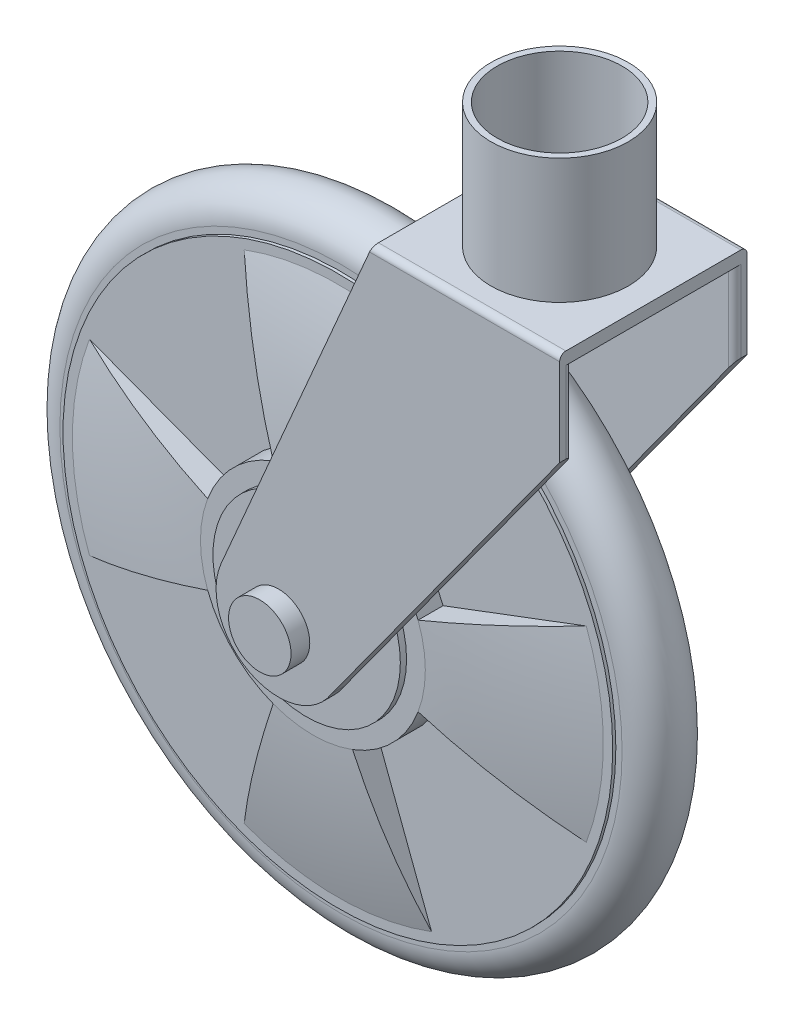
from build123d import *

# Parameters (mm, degrees)
RESSALTO_EXTRUS_O1_DEPTH  = 4
ESBO_O5_R                 = 15
RESSALTO_EXTRUS_O2_DEPTH  = 1
ESBO_O6_R                 = 5
CORTE_EXTRUS_O1_DEPTH     = 74.763134559
RESSALTO_EXTRUS_O11_DEPTH = 15
CASCA4_T                  = -2
ESBO_O18_R                = 5
CORTE_EXTRUS_O2_DEPTH     = 30
ESBO_O19_R                = 5
RESSALTO_EXTRUS_O12_DEPTH = 18
ESBO_O20_R                = 11
ESBO_O20_R_2              = 10
EXTRUS_O_FINA4_DEPTH      = 20
FILETE1_R                 = 1
FILETE2_R                 = 1


with BuildPart() as part:
    # Esboço1 → Revolução3 (revolve)
    with BuildSketch(Plane(origin=(0, 0, 0), x_dir=(1, 0, 0), z_dir=(0, 1, 0))):
        with BuildLine():
            Line((-45, 5), (-44, 5))
            Line((-44, 5), (-44, 5.5))
            Line((-44, 5.5), (0, 5.5))
            Line((0, 5.5), (0, -5.5))
            Line((0, -5.5), (-44, -5.5))
            Line((-44, -5.5), (-44, -5))
            Line((-44, -5), (-45, -5))
            ThreePointArc((-45, -5), (-50, 0), (-45, 5))
        make_face()
    revolve(axis=Axis((0, 0, 0), (0, 0, -1)))

    # Esboço3 → Ressalto-extrusão1 (add)
    with BuildSketch(Plane.XY.offset(5.5)):
        with BuildLine():
            Line((-15, 39.764934301), (-6.352941176, 16.841619234))
            ThreePointArc((-6.352941176, 16.841619234), (-12.727922061, 12.727922061), (-16.841619234, 6.352941176))
            Line((-16.841619234, 6.352941176), (-39.764934301, 15))
            ThreePointArc((-39.764934301, 15), (-42.5, 0), (-39.764934301, -15))
            Line((-39.764934301, -15), (-16.841619234, -6.352941176))
            ThreePointArc((-16.841619234, -6.352941176), (-12.727922061, -12.727922061), (-6.352941176, -16.841619234))
            Line((-6.352941176, -16.841619234), (-15, -39.764934301))
            ThreePointArc((-15, -39.764934301), (0, -42.5), (15, -39.764934301))
            Line((15, -39.764934301), (6.352941176, -16.841619234))
            ThreePointArc((6.352941176, -16.841619234), (12.727922061, -12.727922061), (16.841619234, -6.352941176))
            Line((16.841619234, -6.352941176), (39.764934301, -15))
            ThreePointArc((39.764934301, -15), (42.5, 0), (39.764934301, 15))
            Line((39.764934301, 15), (16.841619234, 6.352941176))
            ThreePointArc((16.841619234, 6.352941176), (12.727922061, 12.727922061), (6.352941176, 16.841619234))
            Line((6.352941176, 16.841619234), (15, 39.764934301))
            ThreePointArc((15, 39.764934301), (0, 42.5), (-15, 39.764934301))
        make_face()
    ressalto_extrus_o1 = extrude(amount=RESSALTO_EXTRUS_O1_DEPTH)

    # Esboço4 → Corte-Revolução1 (revolve, cut)
    with BuildSketch(Plane(origin=(0, 0, 0), x_dir=(0, 0, -1), z_dir=(1, 0, 0))):
        with BuildLine():
            Line((-5.5, 42.5), (-20.3940348, 42.5))
            Line((-20.3940348, 42.5), (-19.720524283, 18))
            Line((-19.720524283, 18), (-9.5, 18))
            ThreePointArc((-9.5, 18), (-8.151622138, 30.356387288), (-5.5, 42.5))
        make_face()
    corte_revolu_o1 = revolve(axis=Axis((0, 0, 0), (0, 0, 1)), mode=Mode.SUBTRACT)

    # Esboço5 → Ressalto-extrusão2 (add)
    with BuildSketch(Plane.XY.offset(9.5)):
        Circle(ESBO_O5_R)
    ressalto_extrus_o2 = extrude(amount=RESSALTO_EXTRUS_O2_DEPTH)

    # Espelhar1: Ressalto-extrusão1, Corte-Revolução1, Ressalto-extrusão2 across plane
    add(ressalto_extrus_o1.mirror(Plane.XY))
    add(corte_revolu_o1.mirror(Plane.XY), mode=Mode.SUBTRACT)
    add(ressalto_extrus_o2.mirror(Plane.XY))

    # Esboço6 → Corte-extrusão1 (cut, through all)
    with BuildSketch(Plane.XY.offset(10.5)):
        Circle(ESBO_O6_R)
    extrude(amount=-CORTE_EXTRUS_O1_DEPTH, mode=Mode.SUBTRACT)


with BuildPart() as body_2:
    # Esboço17 → Ressalto-extrusão11 (new, symmetric)
    with BuildSketch(Plane.XY):
        with BuildLine():
            Line((15, 60), (45, 60))
            Line((45, 60), (45, 45))
            Line((45, 45), (8.516255825, -5.24150615))
            ThreePointArc((8.516255825, -5.24150615), (-4.613797463, -8.872027557), (-9.181612248, 3.962069729))
            Line((-9.181612248, 3.962069729), (15, 60))
        make_face()
    extrude(amount=RESSALTO_EXTRUS_O11_DEPTH, both=True)

    # Casca4
    casca4_openings = [body_2.faces().sort_by_distance(p)[0] for p in [
        (-4.613797463, -8.872027557, 0),
        (2.909193876, 31.981034864, 0),
        (45, 52.5, 0),
        (26.758127913, 19.879246925, 0),
    ]]
    offset(amount=CASCA4_T, openings=casca4_openings, kind=Kind.INTERSECTION)

    # Esboço18 → Corte-extrusão2 (cut)
    with BuildSketch(Plane.XY.offset(15)):
        Circle(ESBO_O18_R)
    extrude(amount=-CORTE_EXTRUS_O2_DEPTH, mode=Mode.SUBTRACT)


with BuildPart() as body_3:
    # Esboço19 → Ressalto-extrusão12 (new, symmetric)
    with BuildSketch(Plane.XY):
        Circle(ESBO_O19_R)
    extrude(amount=RESSALTO_EXTRUS_O12_DEPTH, both=True)


with BuildPart() as body_4:
    # Esboço20 → Extrusão-Fina4 (new body)
    with BuildSketch(Plane(origin=(0, 60, 0), x_dir=(1, 0, 0), z_dir=(0, 1, 0))):
        with Locations((30, 0)):
            Circle(ESBO_O20_R)
        with Locations((30, 0)):
            Circle(ESBO_O20_R_2, mode=Mode.SUBTRACT)
    extrude(amount=EXTRUS_O_FINA4_DEPTH)

    # Combinar1: union body 2
    add(body_2.part)

    # Filete1
    filete1_edges = [body_4.edges().sort_by_distance(p)[0] for p in [
        (30, 60, -15),
        (30, 60, 15),
    ]]
    fillet(filete1_edges, radius=FILETE1_R)

    # Filete2
    filete2_edges = [body_4.edges().sort_by_distance(p)[0] for p in [
        (45, 51.5, -13),
        (45, 51.5, 13),
    ]]
    fillet(filete2_edges, radius=FILETE2_R)


solid = Compound([part.part, body_3.part, body_4.part])
